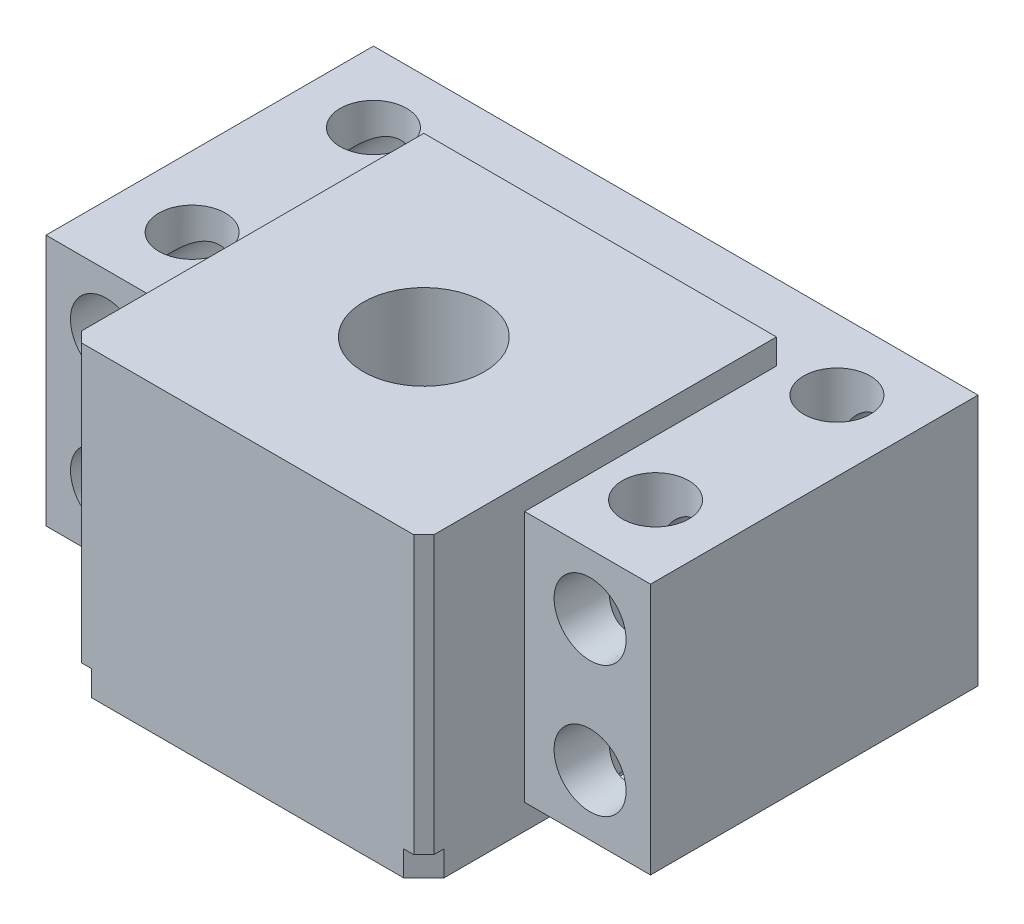
from build123d import *

# Parameters (mm, degrees)
SKETCH_1_W             = 60
SKETCH_1_H             = 25
EXTRUDE_1_DEPTH        = 32.5
SKETCH_2_R             = 3.3
SKETCH_2_R_2           = 3.300235
SKETCH_2_R_3           = 3.300232814
CUT_EXTRUDE_1_DEPTH    = 51.806003582
F_1_16_RC_1_AT_2_COUNT = 2
F_1_16_RC_1_AT_2_PITCH = 13
F_1_16_RC_1_AT_3_COUNT = 2
F_1_16_RC_1_AT_3_PITCH = 48
F_1_16_RC_1_AT_4_COUNT = 2
F_1_16_RC_1_AT_4_PITCH = 49.729267037
SKETCH_5_W             = 35
SKETCH_5_H             = 35
EXTRUDE_2_DEPTH        = 27.5
CHAMFER_1_SIZE         = 1
SKETCH_5_2_W           = 35
SKETCH_5_2_H           = 35
EXTRUDE_3_DEPTH        = 2.5
CHAMFER_2_SIZE         = 2
CUT_EXTRUDE_2_DEPTH    = 2.5
SKETCH_7_R             = 6
CUT_EXTRUDE_3_DEPTH    = 61.052060747


with BuildPart() as part:
    # 스케치1 → 보스-돌출1 (new body)
    with BuildSketch(Plane.XY):
        Rectangle(SKETCH_1_W, SKETCH_1_H)
    extrude(amount=EXTRUDE_1_DEPTH)

    # 스케치2 → 컷-돌출1 (cut, through all)
    with BuildSketch(Plane.XZ.offset(12.5)):
        with Locations(Location((-23, 7, 0), (0, 0, 270))):
            Circle(SKETCH_2_R)
        with Locations(Location((23, 7, 0), (0, 0, 270))):
            Circle(SKETCH_2_R_2)
        with Locations(Location((23, 25, 0), (0, 0, 270))):
            Circle(SKETCH_2_R_2)
        with Locations(Location((-23, 25, 0), (0, 0, 270))):
            Circle(SKETCH_2_R_3)
    extrude(amount=-CUT_EXTRUDE_1_DEPTH, mode=Mode.SUBTRACT)

    # 스케치4 → 1/16 Rc 나사 구멍1 (revolve, cut)
    with BuildSketch(Plane(origin=(-24, 6.5, 32.5), x_dir=(0, -1, 0), z_dir=(1, 0, 0))):
        Polygon((0, 0), (0, 41.832624888), (3.05, 40), (3.05, 7.4), (3.339997004, 7.4), (3.571, 0), align=None)
    f_1_16_rc_1 = revolve(axis=Axis((-24, 6.5, 38.85), (0, 0, -1)), mode=Mode.SUBTRACT)

    # 1/16 Rc 나사 구멍1 at 2: 1/16 Rc 나사 구멍1 ×2
    with Locations(*[(0, -i * F_1_16_RC_1_AT_2_PITCH, 0) for i in range(1, F_1_16_RC_1_AT_2_COUNT)]):
        add(f_1_16_rc_1, mode=Mode.SUBTRACT)

    # 1/16 Rc 나사 구멍1 at 3: 1/16 Rc 나사 구멍1 ×2
    with Locations(*[(i * F_1_16_RC_1_AT_3_PITCH, 0, 0) for i in range(1, F_1_16_RC_1_AT_3_COUNT)]):
        add(f_1_16_rc_1, mode=Mode.SUBTRACT)

    # 1/16 Rc 나사 구멍1 at 4: 1/16 Rc 나사 구멍1 ×2
    with Locations(*[Vector(0.9652263719199435, -0.2614154757283181, 0) * (i * F_1_16_RC_1_AT_4_PITCH) for i in range(1, F_1_16_RC_1_AT_4_COUNT)]):
        add(f_1_16_rc_1, mode=Mode.SUBTRACT)

    # 스케치5 → 보스-돌출2 (add)
    with BuildSketch(Plane.XZ.offset(12.5)):
        with Locations((0, 25)):
            Rectangle(SKETCH_5_W, SKETCH_5_H)
    extrude(amount=-EXTRUDE_2_DEPTH)

    # 모따기1
    chamfer_1_edges = [part.edges().sort_by_distance(p)[0] for p in [
        (17.5, 1.25, 42.5),
        (-17.5, 1.25, 42.5),
    ]]
    chamfer(chamfer_1_edges, length=CHAMFER_1_SIZE)

    # 스케치5<2> → 보스-돌출3 (add)
    with BuildSketch(Plane.XZ.offset(12.5)):
        with Locations((0, 25)):
            Rectangle(SKETCH_5_2_W, SKETCH_5_2_H)
    extrude(amount=EXTRUDE_3_DEPTH)

    # 모따기2
    chamfer_2_edges = [part.edges().sort_by_distance(p)[0] for p in [
        (17.5, -13.75, 7.5),
        (-17.5, -13.75, 7.5),
    ]]
    chamfer(chamfer_2_edges, length=CHAMFER_2_SIZE)

    # 스케치6 → 컷-돌출2 (cut)
    with BuildSketch(Plane.XZ.offset(15)):
        Polygon((-17.5, 40.5), (-15.5, 42.5), (-17.5, 42.5), align=None)
        Polygon((17.5, 42.5), (17.5, 40.5), (15.5, 42.5), align=None)
    extrude(amount=-CUT_EXTRUDE_2_DEPTH, mode=Mode.SUBTRACT)

    # 스케치7 → 컷-돌출3 (cut, through all)
    with BuildSketch(Plane.XZ.offset(15)):
        with Locations(Location((0, 25, 0), (0, 0, 270))):
            Circle(SKETCH_7_R)
    extrude(amount=-CUT_EXTRUDE_3_DEPTH, mode=Mode.SUBTRACT)


solid = part.part
